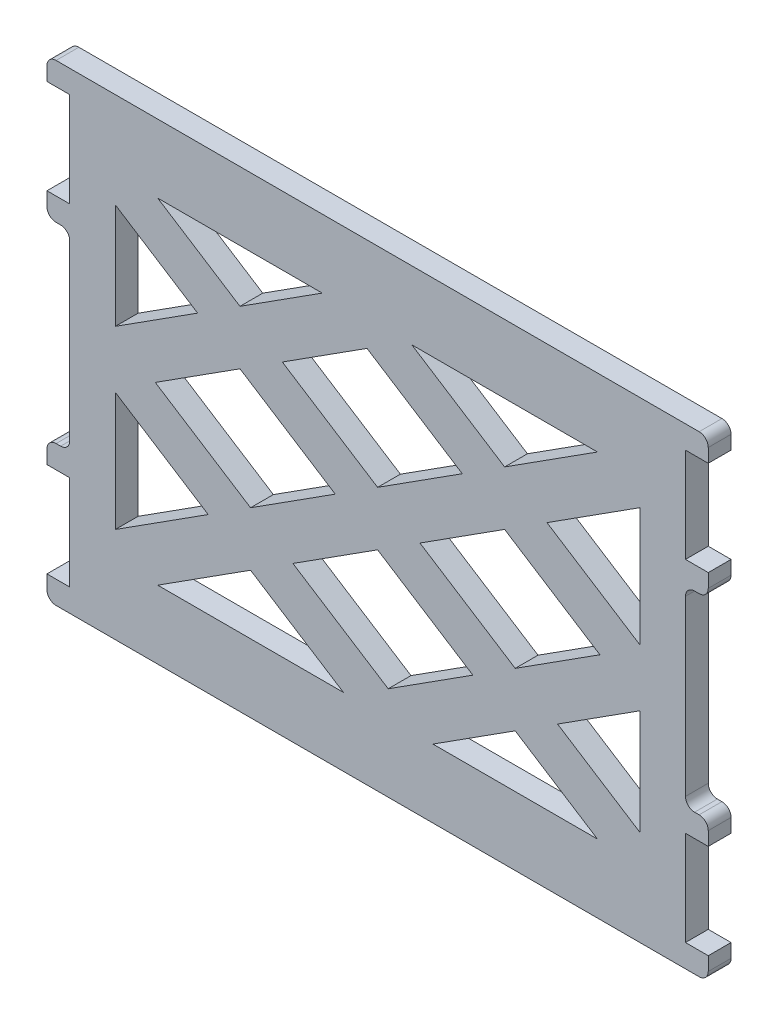
from build123d import *

# Parameters (mm, degrees)
SKETCH1_W               = 54
SKETCH1_H               = 37.4
BOSS_EXTRUDE1_DEPTH     = 2
CUT_EXTRUDE1_DEPTH      = 54.160020758
BOSS_EXTRUDE2_DEPTH     = 2
SKETCH4_W               = 2
SKETCH4_H               = 2
BOSS_EXTRUDE3_DEPTH     = 2
FILLET3_R               = 0.8
MIRROR5_COPY_1_SKETCH_W = 2
MIRROR5_COPY_1_SKETCH_H = 2
MIRROR5_COPY_1_DEPTH    = 2
FILLET3_OF_MIRROR5_R    = 0.8


with BuildPart() as part:
    # Sketch1 → Boss-Extrude1 (new body)
    with BuildSketch(Plane.XY):
        with Locations((-17.911518112, 9.671523538)):
            Rectangle(SKETCH1_W, SKETCH1_H)
    extrude(amount=BOSS_EXTRUDE1_DEPTH)

    # Sketch2 → Cut-Extrude1 (cut, through all)
    with BuildSketch(Plane.XY.offset(2)):
        Polygon((-22.764922959, 24.371523538), (-29.981326879, 19.759300163), (-37.197730799, 24.371523538), align=None)
        Polygon((-33.695114192, 17.385705663), (-40.911518112, 12.773482289), (-40.911518112, 21.997929038), align=None)
        Polygon((-29.981326879, 15.012111163), (-37.408901505, 10.264922163), (-29.052880051, 4.924334538), (-21.625305425, 9.671523538), align=None)
        Polygon((-18.83996494, 22.132894663), (-26.267539566, 17.385705663), (-17.911518112, 12.045118038), (-10.483943486, 16.792307038), align=None)
        Polygon((1.374694575, 24.371523538), (-14.915006921, 24.371523538), (-6.770156173, 19.165901538), align=None)
        Polygon((-3.05636886, 16.792307038), (5.088481888, 11.586685039), (5.088481888, 21.997929038), align=None)
        Polygon((-6.770156173, 14.418712538), (-14.197730799, 9.671523538), (-5.841709344, 4.330935913), (1.585865282, 9.078124913), align=None)
        Polygon((-17.911518112, 7.297929038), (-25.339092738, 2.550740038), (-16.983071283, -2.789847587), (-9.555496657, 1.957341413), align=None)
        Polygon((-29.052880051, 0.177145538), (-20.908029303, -5.028476462), (-37.197730799, -5.028476462), align=None)
        Polygon((-40.911518112, 7.756362038), (-32.766667364, 2.550740038), (-40.911518112, -2.654881962), align=None)
        Polygon((-13.058113264, -5.028476462), (-5.841709344, -0.416253087), (1.374694575, -5.028476462), align=None)
        Polygon((-2.127922031, 1.957341413), (5.088481888, 6.569564788), (5.088481888, -2.654881962), align=None)
    extrude(amount=-CUT_EXTRUDE1_DEPTH, mode=Mode.SUBTRACT)

    # Sketch3 → Boss-Extrude2 (add)
    with BuildSketch(Plane.XZ.offset(9.028476462)):
        Polygon((9.088481888, 2), (11.088481888, 2), (11.088481888, 0), (9.088481888, 0), (-44.911518112, 0), (-46.911518112, 0), (-46.911518112, 2), (-44.911518112, 2), align=None)
    boss_extrude2 = extrude(amount=BOSS_EXTRUDE2_DEPTH)

    # Sketch4 → Boss-Extrude3 (add)
    with BuildSketch(Plane(origin=(9.088481888, 0, 0), x_dir=(0, 0, -1), z_dir=(1, 0, 0))):
        with Locations((-1, 0.271523538)):
            Rectangle(SKETCH4_W, SKETCH4_H)
    boss_extrude3 = extrude(amount=BOSS_EXTRUDE3_DEPTH)

    # Mirror2: Boss-Extrude3 across plane
    add(boss_extrude3.mirror(Plane.ZY.offset(17.911518112)))

    # Fillet3
    fillet3_edges = [part.edges().sort_by_distance(p)[0] for p in [
        (9.088481888, 1.271523538, 1),
        (11.088481888, 1.271523538, 1),
        (-46.911518112, 1.271523538, 1),
        (-44.911518112, 1.271523538, 1),
        (-46.911518112, -11.028476462, 1),
        (11.088481888, -11.028476462, 1),
    ]]
    fillet(fillet3_edges, radius=FILLET3_R)

    # Mirror5: Boss-Extrude2, Boss-Extrude3 across plane
    add(boss_extrude2.mirror(Plane(origin=(0, 9.671523538, 0), x_dir=(0, 0, 1), z_dir=(0, -1, 0))))
    add(boss_extrude3.mirror(Plane(origin=(0, 9.671523538, 0), x_dir=(0, 0, 1), z_dir=(0, -1, 0))))

    # Mirror5 copy 1 sketch → Mirror5 copy 1 (add)
    with BuildSketch(Plane(origin=(-44.911518112, 19.343047076, 0), x_dir=(0, 0, -1), z_dir=(-1, 0, 0))):
        with Locations((-1, 0.271523538)):
            Rectangle(MIRROR5_COPY_1_SKETCH_W, MIRROR5_COPY_1_SKETCH_H)
    extrude(amount=MIRROR5_COPY_1_DEPTH)

    # Fillet3 of Mirror5
    fillet3_of_mirror5_edges = [part.edges().sort_by_distance(p)[0] for p in [
        (9.088481888, 18.071523538, 1),
        (11.088481888, 18.071523538, 1),
        (-46.911518112, 18.071523538, 1),
        (-44.911518112, 18.071523538, 1),
        (-46.911518112, 30.371523538, 1),
        (11.088481888, 30.371523538, 1),
    ]]
    fillet(fillet3_of_mirror5_edges, radius=FILLET3_OF_MIRROR5_R)


solid = part.part
